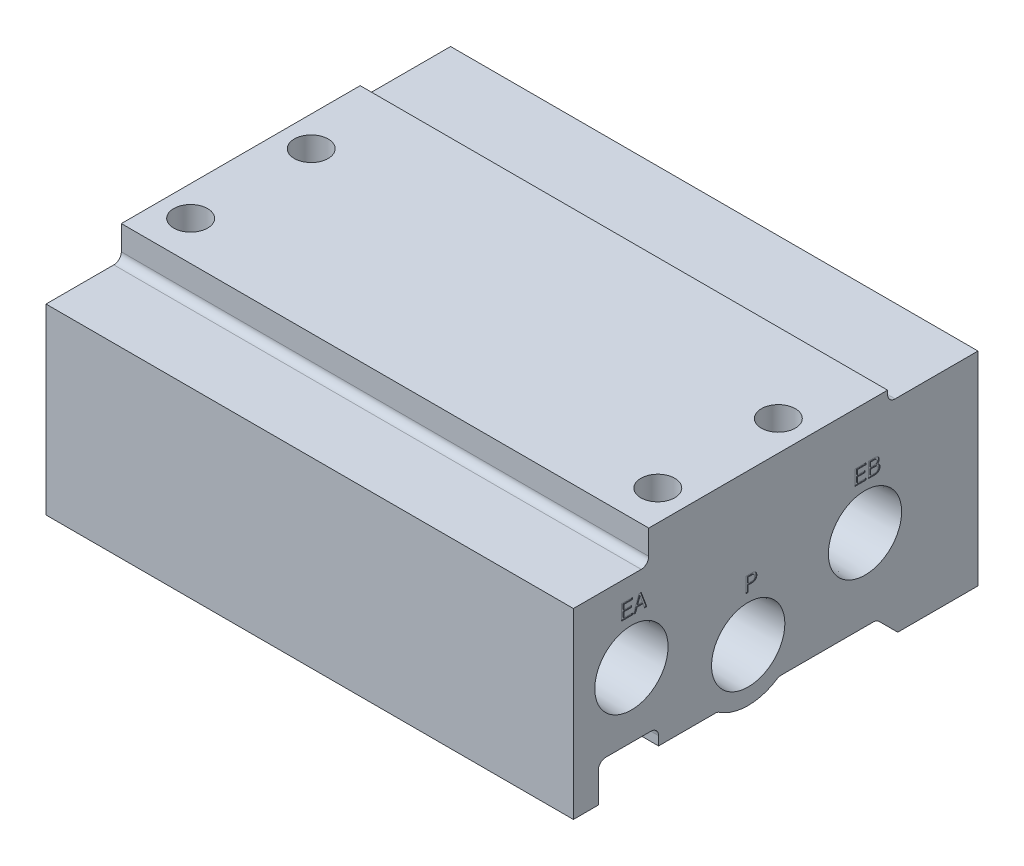
from build123d import *

# Parameters (mm, degrees)
ALUM_EXT_SKETCH_W          = 53.7
ALUM_EXT_SKETCH_H          = 28.5
ALUM_EXT_DEPTH             = 70
MGT_HOLES_SKETCH_R         = 2.25
MGT_HOLES_DEPTH            = 81.207060163
TOP_PROFILE_41_SKETCH_W    = 10
TOP_PROFILE_41_SKETCH_H    = 4.25
TOP_PROFILE_41_SKETCH_W_2  = 12
TOP_PROFILE_41_SKETCH_H_2  = 1.5
TOP_PROFILE_41_DEPTH       = 81.207060163
BOTTOM_PROFILE_41_DEPTH    = 81.207060163
ROUNDS_41_R                = 1
PORTS_AT_2_COUNT           = 2
PORTS_AT_2_PITCH           = 16.317475295
PORTS_AT_3_COUNT           = 2
PORTS_AT_3_PITCH           = 16.317475295
PORTS_MIRROR_AT_2_COUNT    = 2
PORTS_MIRROR_AT_2_PITCH    = 16.317475295
PORTS_MIRROR_AT_3_COUNT    = 2
PORTS_MIRROR_AT_3_PITCH    = 31
F_41_42_PORT_LABELS1_DEPTH = 0.1
F_41_42_PORT_LABELS2_DEPTH = 0.1
F_41_42_A_B_LABELS_DEPTH   = 0.1


with BuildPart() as part:
    # Alum Ext Sketch → Alum Ext (new body)
    with BuildSketch(Plane(origin=(0, 0, 0), x_dir=(0, 0, -1), z_dir=(1, 0, 0))):
        with Locations((0, -14.25)):
            Rectangle(ALUM_EXT_SKETCH_W, ALUM_EXT_SKETCH_H)
    extrude(amount=-ALUM_EXT_DEPTH)

    # MGT_Holes Sketch → MGT_Holes (cut, through all)
    with BuildSketch(Plane(origin=(0, 0, 0), x_dir=(1, 0, 0), z_dir=(0, 1, 0))):
        with Locations(Location((-66, 4.35, 0), (0, 0, 270))):
            Circle(MGT_HOLES_SKETCH_R)
        with Locations(Location((-66, -11.65, 0), (0, 0, 90))):
            Circle(MGT_HOLES_SKETCH_R)
        with Locations(Location((-4, 4.35, 0), (0, 0, 270))):
            Circle(MGT_HOLES_SKETCH_R)
        with Locations(Location((-4, -11.65, 0), (0, 0, 270))):
            Circle(MGT_HOLES_SKETCH_R)
    extrude(amount=-MGT_HOLES_DEPTH, mode=Mode.SUBTRACT)

    # Top_Profile_41 Sketch → Top_Profile_41 (cut, through all)
    with BuildSketch(Plane(origin=(0, 0, 0), x_dir=(0, 0, -1), z_dir=(1, 0, 0))):
        with Locations((-21.85, -2.125)):
            Rectangle(TOP_PROFILE_41_SKETCH_W, TOP_PROFILE_41_SKETCH_H)
        with Locations((20.85, -0.75)):
            Rectangle(TOP_PROFILE_41_SKETCH_W_2, TOP_PROFILE_41_SKETCH_H_2)
    extrude(amount=-TOP_PROFILE_41_DEPTH, mode=Mode.SUBTRACT)

    # Bottom_Profile_41 Sketch → Bottom_Profile_41 (cut, through all)
    with BuildSketch(Plane(origin=(0, 0, 0), x_dir=(0, 0, -1), z_dir=(1, 0, 0))):
        with BuildLine():
            Line((16.2, -28.5), (13.4, -25.7))
            Line((13.4, -25.7), (0.413249931, -25.7))
            ThreePointArc((0.413249931, -25.7), (-3.65, -27), (-7.713249931, -25.7))
            Line((-7.713249931, -25.7), (-15.55, -25.7))
            Line((-15.55, -25.7), (-15.55, -23.5))
            Line((-15.55, -23.5), (-23.55, -23.5))
            Line((-23.55, -23.5), (-23.55, -28.5))
            Line((-23.55, -28.5), (16.2, -28.5))
        make_face()
    extrude(amount=-BOTTOM_PROFILE_41_DEPTH, mode=Mode.SUBTRACT)

    # Rounds_41
    rounds_41_edges = [part.edges().sort_by_distance(p)[0] for p in [
        (-35, -4.25, 16.85),
        (-35, -1.5, -14.85),
        (-35, -25.7, -0.413249931),
        (-35, -23.5, 23.55),
        (-35, -23.5, 15.55),
        (-35, -25.7, 7.713249931),
        (-35, -25.7, -13.4),
    ]]
    fillet(rounds_41_edges, radius=ROUNDS_41_R)

    # Ports Profile Sketch → Ports (revolve, cut)
    with BuildSketch(Plane(origin=(0, -20, 3.65), x_dir=(0, 0, -1), z_dir=(0, 1, 0))):
        Polygon((0, 0), (0, 22.45), (3.95, 18.5), (3.95, 7.4), (4.632997004, 7.4), (4.864, 0), align=None)
    ports = revolve(axis=Axis((6.35, -20, 3.65), (-1, 0, 0)), mode=Mode.SUBTRACT)

    # Ports at 2: Ports ×2
    with Locations(*[Vector(0, 0.3125483512508122, -0.9499018518407042) * (i * PORTS_AT_2_PITCH) for i in range(1, PORTS_AT_2_COUNT)]):
        add(ports, mode=Mode.SUBTRACT)

    # Ports at 3: Ports ×2
    with Locations(*[Vector(0, 0.3125483512508122, 0.9499018518407041) * (i * PORTS_AT_3_PITCH) for i in range(1, PORTS_AT_3_COUNT)]):
        add(ports, mode=Mode.SUBTRACT)

    # Ports Mirror Profile Sketch → Ports Mirror (revolve, cut)
    with BuildSketch(Plane(origin=(-70, -14.9, -11.85), x_dir=(0, 0, 1), z_dir=(0, 1, 0))):
        Polygon((0, 0), (0, 15.885), (3.95, 11.935), (3.95, 7.4), (4.632997004, 7.4), (4.864, 0), align=None)
    ports_mirror = revolve(axis=Axis((-76.35, -14.9, -11.85), (1, 0, 0)), mode=Mode.SUBTRACT)

    # Ports Mirror at 2: Ports Mirror ×2
    with Locations(*[Vector(0, -0.3125483512508122, 0.9499018518407042) * (i * PORTS_MIRROR_AT_2_PITCH) for i in range(1, PORTS_MIRROR_AT_2_COUNT)]):
        add(ports_mirror, mode=Mode.SUBTRACT)

    # Ports Mirror at 3: Ports Mirror ×2
    with Locations(*[(0, 0, i * PORTS_MIRROR_AT_3_PITCH) for i in range(1, PORTS_MIRROR_AT_3_COUNT)]):
        add(ports_mirror, mode=Mode.SUBTRACT)

    # 41,42 Port Labels1 Sketch → 41,42 Port Labels1 (cut)
    # profile 1 of 5: a face of its own
    with BuildSketch(Plane.ZY.offset(70)):
        Polygon((-13.144871795, -8.9), (-13.144871795, -6.9), (-11.731410256, -6.9), (-11.731410256, -7.130769231), (-12.862820513, -7.130769231), (-12.862820513, -7.746153846), (-11.817948718, -7.746153846), (-11.817948718, -7.976923077), (-12.862820513, -7.976923077), (-12.862820513, -8.669230769), (-11.708974359, -8.669230769), (-11.708974359, -8.9), align=None)
    # profile 2 of 5: a face of its own
    with BuildSketch(Plane.ZY.offset(70)):
        with BuildLine():
            Line((-11.375641026, -8.9), (-11.375641026, -6.9))
            Line((-11.375641026, -6.9), (-10.582371795, -6.9))
            add(Edge.make_bspline(
                [(-10.582371795, -6.9), (-10.557520601, -6.900391088), (-10.509221677, -6.901151178), (-10.439257463, -6.906808568), (-10.373884128, -6.915794729), (-10.313491954, -6.928977632), (-10.25772712, -6.945607443), (-10.206981233, -6.966644139), (-10.160714162, -6.990826937), (-10.119486132, -7.019131964), (-10.082912178, -7.050918934), (-10.051607199, -7.087006382), (-10.024425363, -7.126312863), (-10.002795087, -7.169699096), (-9.985826511, -7.216613207), (-9.974014126, -7.267309873), (-9.966656438, -7.321659157), (-9.965816477, -7.359110147), (-9.965384615, -7.378365385)],
                knots=[0, 0, 0, 0, 1.338531614, 2.601470082, 3.778553788, 4.890456792, 5.928162005, 6.908738963, 7.84520586, 8.735147048, 9.596633689, 10.447968487, 11.301973765, 12.164180963, 13.051676454, 13.983434255, 14.963192844, 16, 16, 16, 16], degree=3))
            add(Edge.make_bspline(
                [(-9.965384615, -7.378365385), (-9.966331591, -7.402996395), (-9.968168925, -7.450785796), (-9.981718133, -7.519887959), (-10.005663085, -7.582918484), (-10.038410282, -7.640323126), (-10.080645807, -7.691469707), (-10.132507487, -7.735784439), (-10.193110711, -7.77443215), (-10.238424067, -7.793555438), (-10.261858974, -7.803445513)],
                knots=[0, 0, 0, 0, 1.064089938, 2.064560856, 3.027045975, 3.965441717, 4.908263127, 5.877849772, 6.902478258, 8, 8, 8, 8], degree=3))
            add(Edge.make_bspline(
                [(-10.261858974, -7.803445513), (-10.246569522, -7.806518626), (-10.216485798, -7.812565323), (-10.17316555, -7.826052918), (-10.132251748, -7.841956303), (-10.093880076, -7.860736947), (-10.058519403, -7.883036867), (-10.02554128, -7.907811801), (-9.995201163, -7.935720854), (-9.967752142, -7.966578157), (-9.94267115, -7.999705375), (-9.921668464, -8.035541546), (-9.903328698, -8.073092565), (-9.888526343, -8.112963113), (-9.876994446, -8.155075497), (-9.868507088, -8.199259529), (-9.863726514, -8.245513022), (-9.863126284, -8.276992465), (-9.862820513, -8.293028846)],
                knots=[0, 0, 0, 0, 1.079472139, 2.123983387, 3.137357801, 4.117691995, 5.07752268, 6.028353704, 6.970961659, 7.927265266, 8.885490285, 9.843581377, 10.799169054, 11.776706782, 12.784239396, 13.820032524, 14.889472473, 16, 16, 16, 16], degree=3))
            add(Edge.make_bspline(
                [(-9.862820513, -8.293028846), (-9.863272496, -8.315767522), (-9.864153514, -8.360090374), (-9.873541022, -8.424660596), (-9.887061044, -8.485768657), (-9.907353971, -8.543283868), (-9.933566292, -8.597000116), (-9.964872333, -8.647657469), (-10.002489133, -8.694254066), (-10.045355165, -8.737068494), (-10.093055612, -8.775646479), (-10.145401463, -8.808971319), (-10.201906819, -8.836986969), (-10.262136906, -8.860475813), (-10.326816833, -8.877901069), (-10.395416655, -8.890532564), (-10.468116052, -8.898929064), (-10.517977934, -8.899637332), (-10.543509615, -8.9)],
                knots=[0, 0, 0, 0, 1.058427598, 2.063116183, 3.033417234, 3.969927738, 4.896405358, 5.812972495, 6.737861532, 7.679194237, 8.630321786, 9.589794139, 10.563499171, 11.563941868, 12.596215416, 13.678433312, 14.811246201, 16, 16, 16, 16], degree=3))
            Line((-10.543509615, -8.9), (-11.375641026, -8.9))
        make_face()
        with BuildLine():
            Line((-11.093589744, -7.720512821), (-10.638060897, -7.720512821))
            add(Edge.make_bspline(
                [(-10.638060897, -7.720512821), (-10.62189856, -7.72024581), (-10.59060934, -7.719728896), (-10.545208349, -7.716795414), (-10.503095771, -7.710636868), (-10.464283505, -7.702711026), (-10.428663129, -7.693061693), (-10.39684222, -7.679824467), (-10.367793522, -7.665385266), (-10.342235553, -7.64779035), (-10.319629027, -7.628173795), (-10.300015633, -7.605914124), (-10.284162537, -7.580643527), (-10.270210543, -7.55333256), (-10.259923231, -7.523089629), (-10.252860224, -7.490409561), (-10.248348588, -7.45527911), (-10.247747178, -7.430997327), (-10.247435897, -7.418429487)],
                knots=[0, 0, 0, 0, 1.368886017, 2.65007316, 3.849640785, 4.969751217, 6.004381673, 6.968357812, 7.883879336, 8.746530739, 9.588092002, 10.41369514, 11.248159001, 12.107988605, 13.005734059, 13.944160956, 14.935932503, 16, 16, 16, 16], degree=3))
            add(Edge.make_bspline(
                [(-10.247435897, -7.418429487), (-10.24779526, -7.406534873), (-10.248487838, -7.383611119), (-10.252344592, -7.350275069), (-10.259615487, -7.319417291), (-10.2694704, -7.29082689), (-10.28256798, -7.264808482), (-10.298163447, -7.241021057), (-10.316774453, -7.219617856), (-10.338193209, -7.200634591), (-10.362634513, -7.184106045), (-10.389977449, -7.169577213), (-10.420615726, -7.157824898), (-10.454032304, -7.147613488), (-10.490564803, -7.140314754), (-10.529999659, -7.134572338), (-10.572575304, -7.131523238), (-10.60199904, -7.131026383), (-10.617227564, -7.130769231)],
                knots=[0, 0, 0, 0, 1.064043854, 2.05066597, 2.995108535, 3.894129092, 4.74873584, 5.593437176, 6.431611697, 7.277662936, 8.145602371, 9.064553025, 10.040417484, 11.075719197, 12.186014413, 13.368359838, 14.637970495, 16, 16, 16, 16], degree=3))
            Line((-10.617227564, -7.130769231), (-11.093589744, -7.130769231))
            Line((-11.093589744, -7.130769231), (-11.093589744, -7.720512821))
        make_face(mode=Mode.SUBTRACT)
        with BuildLine():
            Line((-11.093589744, -8.669230769), (-10.566746795, -8.669230769))
            add(Edge.make_bspline(
                [(-10.566746795, -8.669230769), (-10.549908372, -8.668922161), (-10.517373227, -8.668325869), (-10.470137599, -8.663774034), (-10.425994956, -8.656854934), (-10.385013028, -8.64634983), (-10.346971081, -8.633180858), (-10.312127837, -8.616877954), (-10.280547117, -8.597345386), (-10.251784041, -8.575352814), (-10.226609275, -8.550046268), (-10.204679995, -8.522071895), (-10.186188284, -8.49137213), (-10.170917321, -8.458069746), (-10.159316799, -8.421991925), (-10.151012013, -8.383343954), (-10.145625468, -8.342058175), (-10.145127121, -8.313612472), (-10.144871795, -8.299038462)],
                knots=[0, 0, 0, 0, 1.261340787, 2.437158505, 3.552412744, 4.605618057, 5.602418951, 6.564726798, 7.481099983, 8.379712099, 9.271165627, 10.147841252, 11.036708081, 11.950072001, 12.886651798, 13.869902527, 14.90865543, 16, 16, 16, 16], degree=3))
            add(Edge.make_bspline(
                [(-10.144871795, -8.299038462), (-10.145117446, -8.284595974), (-10.145594563, -8.256544995), (-10.151054338, -8.215943132), (-10.159140342, -8.17810658), (-10.171288059, -8.143473319), (-10.18652651, -8.111724261), (-10.205588286, -8.083183638), (-10.227647172, -8.057184402), (-10.253710324, -8.034583368), (-10.28331899, -8.01494812), (-10.31638283, -7.997503895), (-10.353598, -7.98333953), (-10.394496601, -7.971081379), (-10.439692519, -7.962804431), (-10.488439021, -7.955798704), (-10.541174333, -7.951838231), (-10.577557944, -7.951471772), (-10.596394231, -7.951282051)],
                knots=[0, 0, 0, 0, 1.058252033, 2.055394168, 2.998523969, 3.890395008, 4.739981298, 5.573732922, 6.40003374, 7.23274972, 8.093659094, 9.000297479, 9.967667442, 11.00874663, 12.12639854, 13.332554366, 14.619027337, 16, 16, 16, 16], degree=3))
            Line((-10.596394231, -7.951282051), (-11.093589744, -7.951282051))
            Line((-11.093589744, -7.951282051), (-11.093589744, -8.669230769))
        make_face(mode=Mode.SUBTRACT)
    # profile 3 of 5: a face of its own
    with BuildSketch(Plane.ZY.offset(70)):
        with BuildLine():
            Line((3.355128205, -14), (3.355128205, -12))
            Line((3.355128205, -12), (4.095913462, -12))
            add(Edge.make_bspline(
                [(4.095913462, -12), (4.12409362, -12.000249378), (4.177002091, -12.000717587), (4.250934098, -12.003608091), (4.314154858, -12.009200397), (4.368073681, -12.016451865), (4.415166702, -12.02754219), (4.458606554, -12.040013914), (4.499344903, -12.056098279), (4.524832794, -12.069234093), (4.537419872, -12.075721154)],
                knots=[0, 0, 0, 0, 1.493455121, 2.803973871, 3.919514338, 4.856337602, 5.683863995, 6.481055044, 7.249876038, 8, 8, 8, 8], degree=3))
            add(Edge.make_bspline(
                [(4.537419872, -12.075721154), (4.557109161, -12.087505308), (4.596238242, -12.110924292), (4.646867088, -12.157428597), (4.691435381, -12.210646113), (4.726929673, -12.2725773), (4.756116688, -12.340350372), (4.776198097, -12.414407034), (4.789029685, -12.493809121), (4.790347685, -12.548692188), (4.791025641, -12.576923077)],
                knots=[0, 0, 0, 0, 0.930560885, 1.849329941, 2.778623248, 3.742228717, 4.739438803, 5.770715934, 6.853295292, 8, 8, 8, 8], degree=3))
            add(Edge.make_bspline(
                [(4.791025641, -12.576923077), (4.790347059, -12.603953612), (4.78902587, -12.65658169), (4.776100386, -12.733053307), (4.755916476, -12.804708226), (4.727367087, -12.871331941), (4.690898401, -12.932063622), (4.64652939, -12.986531524), (4.594678687, -13.034755885), (4.555051994, -13.060899771), (4.535016026, -13.07411859)],
                knots=[0, 0, 0, 0, 1.106237948, 2.15382993, 3.166616047, 4.14912887, 5.113446575, 6.058253874, 7.018218259, 8, 8, 8, 8], degree=3))
            add(Edge.make_bspline(
                [(4.535016026, -13.07411859), (4.522597077, -13.081071894), (4.497311506, -13.095229151), (4.456117103, -13.111618603), (4.412179284, -13.125952788), (4.372704814, -13.134789239), (4.337996409, -13.140616309), (4.307779075, -13.144194947), (4.273668896, -13.146691653), (4.235640761, -13.149761537), (4.193551564, -13.151643471), (4.147467197, -13.152726574), (4.097518693, -13.153554018), (4.06292769, -13.153746548), (4.045032051, -13.153846154)],
                knots=[0, 0, 0, 0, 1.018466528, 2.073646265, 3.168741587, 4.32666575, 4.966710573, 5.68928523, 6.505122404, 7.416327688, 8.421864515, 9.522294478, 10.718160255, 12, 12, 12, 12], degree=3))
            Line((4.045032051, -13.153846154), (3.637179487, -13.153846154))
            Line((3.637179487, -13.153846154), (3.637179487, -14))
            Line((3.637179487, -14), (3.355128205, -14))
        make_face()
        with BuildLine():
            Line((3.637179487, -12.923076923), (4.087900641, -12.923076923))
            add(Edge.make_bspline(
                [(4.087900641, -12.923076923), (4.106734424, -12.922848085), (4.142970313, -12.922407806), (4.195182234, -12.919020543), (4.2428652, -12.912380011), (4.286306282, -12.90452837), (4.324991337, -12.892914993), (4.359724875, -12.880257808), (4.389709515, -12.863882812), (4.415997913, -12.84536947), (4.43829063, -12.823331396), (4.457379289, -12.798065143), (4.473409826, -12.769311124), (4.486624477, -12.737183964), (4.496532941, -12.70151272), (4.503634352, -12.662491291), (4.508057153, -12.619891899), (4.508660905, -12.590288992), (4.508974359, -12.574919872)],
                knots=[0, 0, 0, 0, 1.418142734, 2.728483292, 3.935852239, 5.042182902, 6.047730313, 6.973980857, 7.819836916, 8.612371598, 9.387426252, 10.169752478, 10.989196503, 11.859387264, 12.779284547, 13.771317079, 14.842921177, 16, 16, 16, 16], degree=3))
            add(Edge.make_bspline(
                [(4.508974359, -12.574919872), (4.508621001, -12.560087188), (4.507941592, -12.531568007), (4.504041052, -12.490281163), (4.497103925, -12.452223938), (4.486320171, -12.417522781), (4.473955018, -12.385611284), (4.457636989, -12.357322195), (4.43872536, -12.332221086), (4.416721841, -12.31008833), (4.391039013, -12.291246478), (4.361972539, -12.274585285), (4.328843401, -12.261233914), (4.292121529, -12.249962633), (4.251491521, -12.241304691), (4.207065619, -12.234912843), (4.15873708, -12.23141909), (4.125299202, -12.230991373), (4.107932692, -12.230769231)],
                knots=[0, 0, 0, 0, 1.160442503, 2.231212519, 3.241398704, 4.180061104, 5.070566702, 5.91288362, 6.725721963, 7.523583634, 8.344772017, 9.210415603, 10.137847341, 11.13257169, 12.212527806, 13.384203378, 14.64144318, 16, 16, 16, 16], degree=3))
            Line((4.107932692, -12.230769231), (3.637179487, -12.230769231))
            Line((3.637179487, -12.230769231), (3.637179487, -12.923076923))
        make_face(mode=Mode.SUBTRACT)
    # profile 4 of 5: a face of its own
    with BuildSketch(Plane.ZY.offset(70)):
        Polygon((17.855128205, -8.9), (17.855128205, -6.9), (19.268589744, -6.9), (19.268589744, -7.130769231), (18.137179487, -7.130769231), (18.137179487, -7.746153846), (19.182051282, -7.746153846), (19.182051282, -7.976923077), (18.137179487, -7.976923077), (18.137179487, -8.669230769), (19.291025641, -8.669230769), (19.291025641, -8.9), align=None)
    # profile 5 of 5: a face of its own
    with BuildSketch(Plane.ZY.offset(70)):
        Polygon((19.419230769, -8.9), (20.149198718, -6.9), (20.447676282, -6.9), (21.188461538, -8.9), (20.895592949, -8.9), (20.68525641, -8.31025641), (19.902403846, -8.31025641), (19.690464744, -8.9), align=None)
        Polygon((19.986137821, -8.079487179), (20.605528846, -8.079487179), (20.297836538, -7.188862179), align=None, mode=Mode.SUBTRACT)
    extrude(amount=-F_41_42_PORT_LABELS1_DEPTH, mode=Mode.SUBTRACT)

    # 41,42 Port Labels2 Sketch → 41,42 Port Labels2 (cut)
    # profile 1 of 5: a face of its own
    with BuildSketch(Plane(origin=(0, 0, 0), x_dir=(0, 0, -1), z_dir=(1, 0, 0))):
        Polygon((-20.444871795, -8.9), (-20.444871795, -6.9), (-19.031410256, -6.9), (-19.031410256, -7.130769231), (-20.162820513, -7.130769231), (-20.162820513, -7.746153846), (-19.117948718, -7.746153846), (-19.117948718, -7.976923077), (-20.162820513, -7.976923077), (-20.162820513, -8.669230769), (-19.008974359, -8.669230769), (-19.008974359, -8.9), align=None)
    # profile 2 of 5: a face of its own
    with BuildSketch(Plane(origin=(0, 0, 0), x_dir=(0, 0, -1), z_dir=(1, 0, 0))):
        Polygon((-18.880769231, -8.9), (-18.150801282, -6.9), (-17.852323718, -6.9), (-17.111538462, -8.9), (-17.404407051, -8.9), (-17.61474359, -8.31025641), (-18.397596154, -8.31025641), (-18.609535256, -8.9), align=None)
        Polygon((-18.313862179, -8.079487179), (-17.694471154, -8.079487179), (-18.002163462, -7.188862179), align=None, mode=Mode.SUBTRACT)
    # profile 3 of 5: a face of its own
    with BuildSketch(Plane(origin=(0, 0, 0), x_dir=(0, 0, -1), z_dir=(1, 0, 0))):
        with BuildLine():
            Line((-3.944871795, -14), (-3.944871795, -12))
            Line((-3.944871795, -12), (-3.204086538, -12))
            add(Edge.make_bspline(
                [(-3.204086538, -12), (-3.17590638, -12.000249378), (-3.122997909, -12.000717587), (-3.049065902, -12.003608091), (-2.985845142, -12.009200397), (-2.931926319, -12.016451865), (-2.884833298, -12.02754219), (-2.841393446, -12.040013914), (-2.800655097, -12.056098279), (-2.775167206, -12.069234093), (-2.762580128, -12.075721154)],
                knots=[0, 0, 0, 0, 1.493455121, 2.803973871, 3.919514338, 4.856337602, 5.683863995, 6.481055044, 7.249876038, 8, 8, 8, 8], degree=3))
            add(Edge.make_bspline(
                [(-2.762580128, -12.075721154), (-2.742890839, -12.087505308), (-2.703761758, -12.110924292), (-2.653132912, -12.157428597), (-2.608564619, -12.210646113), (-2.573070327, -12.2725773), (-2.543883312, -12.340350372), (-2.523801903, -12.414407034), (-2.510970315, -12.493809121), (-2.509652315, -12.548692188), (-2.508974359, -12.576923077)],
                knots=[0, 0, 0, 0, 0.930560885, 1.849329941, 2.778623248, 3.742228717, 4.739438803, 5.770715934, 6.853295292, 8, 8, 8, 8], degree=3))
            add(Edge.make_bspline(
                [(-2.508974359, -12.576923077), (-2.509652941, -12.603953612), (-2.51097413, -12.65658169), (-2.523899614, -12.733053307), (-2.544083524, -12.804708226), (-2.572632913, -12.871331941), (-2.609101599, -12.932063622), (-2.65347061, -12.986531524), (-2.705321313, -13.034755885), (-2.744948006, -13.060899771), (-2.764983974, -13.07411859)],
                knots=[0, 0, 0, 0, 1.106237948, 2.15382993, 3.166616047, 4.14912887, 5.113446575, 6.058253874, 7.018218259, 8, 8, 8, 8], degree=3))
            add(Edge.make_bspline(
                [(-2.764983974, -13.07411859), (-2.777402923, -13.081071894), (-2.802688494, -13.095229151), (-2.843882897, -13.111618603), (-2.887820716, -13.125952788), (-2.927295186, -13.134789239), (-2.962003591, -13.140616309), (-2.992220925, -13.144194947), (-3.026331104, -13.146691653), (-3.064359239, -13.149761537), (-3.106448436, -13.151643471), (-3.152532803, -13.152726574), (-3.202481307, -13.153554018), (-3.23707231, -13.153746548), (-3.254967949, -13.153846154)],
                knots=[0, 0, 0, 0, 1.018466528, 2.073646265, 3.168741587, 4.32666575, 4.966710573, 5.68928523, 6.505122404, 7.416327688, 8.421864515, 9.522294478, 10.718160255, 12, 12, 12, 12], degree=3))
            Line((-3.254967949, -13.153846154), (-3.662820513, -13.153846154))
            Line((-3.662820513, -13.153846154), (-3.662820513, -14))
            Line((-3.662820513, -14), (-3.944871795, -14))
        make_face()
        with BuildLine():
            Line((-3.662820513, -12.923076923), (-3.212099359, -12.923076923))
            add(Edge.make_bspline(
                [(-3.212099359, -12.923076923), (-3.193265576, -12.922848085), (-3.157029687, -12.922407806), (-3.104817766, -12.919020543), (-3.0571348, -12.912380011), (-3.013693718, -12.90452837), (-2.975008663, -12.892914993), (-2.940275125, -12.880257808), (-2.910290485, -12.863882812), (-2.884002087, -12.84536947), (-2.86170937, -12.823331396), (-2.842620711, -12.798065143), (-2.826590174, -12.769311124), (-2.813375523, -12.737183964), (-2.803467059, -12.70151272), (-2.796365648, -12.662491291), (-2.791942847, -12.619891899), (-2.791339095, -12.590288992), (-2.791025641, -12.574919872)],
                knots=[0, 0, 0, 0, 1.418142734, 2.728483292, 3.935852239, 5.042182902, 6.047730313, 6.973980857, 7.819836916, 8.612371598, 9.387426252, 10.169752478, 10.989196503, 11.859387264, 12.779284547, 13.771317079, 14.842921177, 16, 16, 16, 16], degree=3))
            add(Edge.make_bspline(
                [(-2.791025641, -12.574919872), (-2.791378999, -12.560087188), (-2.792058408, -12.531568007), (-2.795958948, -12.490281163), (-2.802896075, -12.452223938), (-2.813679829, -12.417522781), (-2.826044982, -12.385611284), (-2.842363011, -12.357322195), (-2.86127464, -12.332221086), (-2.883278159, -12.31008833), (-2.908960987, -12.291246478), (-2.938027461, -12.274585285), (-2.971156599, -12.261233914), (-3.007878471, -12.249962633), (-3.048508479, -12.241304691), (-3.092934381, -12.234912843), (-3.14126292, -12.23141909), (-3.174700798, -12.230991373), (-3.192067308, -12.230769231)],
                knots=[0, 0, 0, 0, 1.160442503, 2.231212519, 3.241398704, 4.180061104, 5.070566702, 5.91288362, 6.725721963, 7.523583634, 8.344772017, 9.210415603, 10.137847341, 11.13257169, 12.212527806, 13.384203378, 14.64144318, 16, 16, 16, 16], degree=3))
            Line((-3.192067308, -12.230769231), (-3.662820513, -12.230769231))
            Line((-3.662820513, -12.230769231), (-3.662820513, -12.923076923))
        make_face(mode=Mode.SUBTRACT)
    # profile 4 of 5: a face of its own
    with BuildSketch(Plane(origin=(0, 0, 0), x_dir=(0, 0, -1), z_dir=(1, 0, 0))):
        Polygon((10.555128205, -8.9), (10.555128205, -6.9), (11.968589744, -6.9), (11.968589744, -7.130769231), (10.837179487, -7.130769231), (10.837179487, -7.746153846), (11.882051282, -7.746153846), (11.882051282, -7.976923077), (10.837179487, -7.976923077), (10.837179487, -8.669230769), (11.991025641, -8.669230769), (11.991025641, -8.9), align=None)
    # profile 5 of 5: a face of its own
    with BuildSketch(Plane(origin=(0, 0, 0), x_dir=(0, 0, -1), z_dir=(1, 0, 0))):
        with BuildLine():
            Line((12.324358974, -8.9), (12.324358974, -6.9))
            Line((12.324358974, -6.9), (13.117628205, -6.9))
            add(Edge.make_bspline(
                [(13.117628205, -6.9), (13.142479399, -6.900391088), (13.190778323, -6.901151178), (13.260742537, -6.906808568), (13.326115872, -6.915794729), (13.386508046, -6.928977632), (13.44227288, -6.945607443), (13.493018767, -6.966644139), (13.539285838, -6.990826937), (13.580513868, -7.019131964), (13.617087822, -7.050918934), (13.648392801, -7.087006382), (13.675574637, -7.126312863), (13.697204913, -7.169699096), (13.714173489, -7.216613207), (13.725985874, -7.267309873), (13.733343562, -7.321659157), (13.734183523, -7.359110147), (13.734615385, -7.378365385)],
                knots=[0, 0, 0, 0, 1.338531614, 2.601470082, 3.778553788, 4.890456792, 5.928162005, 6.908738963, 7.84520586, 8.735147048, 9.596633689, 10.447968487, 11.301973765, 12.164180963, 13.051676454, 13.983434255, 14.963192844, 16, 16, 16, 16], degree=3))
            add(Edge.make_bspline(
                [(13.734615385, -7.378365385), (13.733668409, -7.402996395), (13.731831075, -7.450785796), (13.718281867, -7.519887959), (13.694336915, -7.582918484), (13.661589718, -7.640323126), (13.619354193, -7.691469707), (13.567492513, -7.735784439), (13.506889289, -7.77443215), (13.461575933, -7.793555438), (13.438141026, -7.803445513)],
                knots=[0, 0, 0, 0, 1.064089938, 2.064560856, 3.027045975, 3.965441717, 4.908263127, 5.877849772, 6.902478258, 8, 8, 8, 8], degree=3))
            add(Edge.make_bspline(
                [(13.438141026, -7.803445513), (13.453430478, -7.806518626), (13.483514202, -7.812565323), (13.52683445, -7.826052918), (13.567748252, -7.841956303), (13.606119924, -7.860736947), (13.641480597, -7.883036867), (13.67445872, -7.907811801), (13.704798837, -7.935720854), (13.732247858, -7.966578157), (13.75732885, -7.999705375), (13.778331536, -8.035541546), (13.796671302, -8.073092565), (13.811473657, -8.112963113), (13.823005554, -8.155075497), (13.831492912, -8.199259529), (13.836273486, -8.245513022), (13.836873716, -8.276992465), (13.837179487, -8.293028846)],
                knots=[0, 0, 0, 0, 1.079472139, 2.123983387, 3.137357801, 4.117691995, 5.07752268, 6.028353704, 6.970961659, 7.927265266, 8.885490285, 9.843581377, 10.799169054, 11.776706782, 12.784239396, 13.820032524, 14.889472473, 16, 16, 16, 16], degree=3))
            add(Edge.make_bspline(
                [(13.837179487, -8.293028846), (13.836727504, -8.315767522), (13.835846486, -8.360090374), (13.826458978, -8.424660596), (13.812938956, -8.485768657), (13.792646029, -8.543283868), (13.766433708, -8.597000116), (13.735127667, -8.647657469), (13.697510867, -8.694254066), (13.654644835, -8.737068494), (13.606944388, -8.775646479), (13.554598537, -8.808971319), (13.498093181, -8.836986969), (13.437863094, -8.860475813), (13.373183167, -8.877901069), (13.304583345, -8.890532564), (13.231883948, -8.898929064), (13.182022066, -8.899637332), (13.156490385, -8.9)],
                knots=[0, 0, 0, 0, 1.058427598, 2.063116183, 3.033417234, 3.969927738, 4.896405358, 5.812972495, 6.737861532, 7.679194237, 8.630321786, 9.589794139, 10.563499171, 11.563941868, 12.596215416, 13.678433312, 14.811246201, 16, 16, 16, 16], degree=3))
            Line((13.156490385, -8.9), (12.324358974, -8.9))
        make_face()
        with BuildLine():
            Line((12.606410256, -7.720512821), (13.061939103, -7.720512821))
            add(Edge.make_bspline(
                [(13.061939103, -7.720512821), (13.07810144, -7.72024581), (13.10939066, -7.719728896), (13.154791651, -7.716795414), (13.196904229, -7.710636868), (13.235716495, -7.702711026), (13.271336871, -7.693061693), (13.30315778, -7.679824467), (13.332206478, -7.665385266), (13.357764447, -7.64779035), (13.380370973, -7.628173795), (13.399984367, -7.605914124), (13.415837463, -7.580643527), (13.429789457, -7.55333256), (13.440076769, -7.523089629), (13.447139776, -7.490409561), (13.451651412, -7.45527911), (13.452252822, -7.430997327), (13.452564103, -7.418429487)],
                knots=[0, 0, 0, 0, 1.368886017, 2.65007316, 3.849640785, 4.969751217, 6.004381673, 6.968357812, 7.883879336, 8.746530739, 9.588092002, 10.41369514, 11.248159001, 12.107988605, 13.005734059, 13.944160956, 14.935932503, 16, 16, 16, 16], degree=3))
            add(Edge.make_bspline(
                [(13.452564103, -7.418429487), (13.45220474, -7.406534873), (13.451512162, -7.383611119), (13.447655408, -7.350275069), (13.440384513, -7.319417291), (13.4305296, -7.29082689), (13.41743202, -7.264808482), (13.401836553, -7.241021057), (13.383225547, -7.219617856), (13.361806791, -7.200634591), (13.337365487, -7.184106045), (13.310022551, -7.169577213), (13.279384274, -7.157824898), (13.245967696, -7.147613488), (13.209435197, -7.140314754), (13.170000341, -7.134572338), (13.127424696, -7.131523238), (13.09800096, -7.131026383), (13.082772436, -7.130769231)],
                knots=[0, 0, 0, 0, 1.064043854, 2.05066597, 2.995108535, 3.894129092, 4.74873584, 5.593437176, 6.431611697, 7.277662936, 8.145602371, 9.064553025, 10.040417484, 11.075719197, 12.186014413, 13.368359838, 14.637970495, 16, 16, 16, 16], degree=3))
            Line((13.082772436, -7.130769231), (12.606410256, -7.130769231))
            Line((12.606410256, -7.130769231), (12.606410256, -7.720512821))
        make_face(mode=Mode.SUBTRACT)
        with BuildLine():
            Line((12.606410256, -8.669230769), (13.133253205, -8.669230769))
            add(Edge.make_bspline(
                [(13.133253205, -8.669230769), (13.150091628, -8.668922161), (13.182626773, -8.668325869), (13.229862401, -8.663774034), (13.274005044, -8.656854934), (13.314986972, -8.64634983), (13.353028919, -8.633180858), (13.387872163, -8.616877954), (13.419452883, -8.597345386), (13.448215959, -8.575352814), (13.473390725, -8.550046268), (13.495320005, -8.522071895), (13.513811716, -8.49137213), (13.529082679, -8.458069746), (13.540683201, -8.421991925), (13.548987987, -8.383343954), (13.554374532, -8.342058175), (13.554872879, -8.313612472), (13.555128205, -8.299038462)],
                knots=[0, 0, 0, 0, 1.261340787, 2.437158505, 3.552412744, 4.605618057, 5.602418951, 6.564726798, 7.481099983, 8.379712099, 9.271165627, 10.147841252, 11.036708081, 11.950072001, 12.886651798, 13.869902527, 14.90865543, 16, 16, 16, 16], degree=3))
            add(Edge.make_bspline(
                [(13.555128205, -8.299038462), (13.554882554, -8.284595974), (13.554405437, -8.256544995), (13.548945662, -8.215943132), (13.540859658, -8.17810658), (13.528711941, -8.143473319), (13.51347349, -8.111724261), (13.494411714, -8.083183638), (13.472352828, -8.057184402), (13.446289676, -8.034583368), (13.41668101, -8.01494812), (13.38361717, -7.997503895), (13.346402, -7.98333953), (13.305503399, -7.971081379), (13.260307481, -7.962804431), (13.211560979, -7.955798704), (13.158825667, -7.951838231), (13.122442056, -7.951471772), (13.103605769, -7.951282051)],
                knots=[0, 0, 0, 0, 1.058252033, 2.055394168, 2.998523969, 3.890395008, 4.739981298, 5.573732922, 6.40003374, 7.23274972, 8.093659094, 9.000297479, 9.967667442, 11.00874663, 12.12639854, 13.332554366, 14.619027337, 16, 16, 16, 16], degree=3))
            Line((13.103605769, -7.951282051), (12.606410256, -7.951282051))
            Line((12.606410256, -7.951282051), (12.606410256, -8.669230769))
        make_face(mode=Mode.SUBTRACT)
    extrude(amount=-F_41_42_PORT_LABELS2_DEPTH, mode=Mode.SUBTRACT)

    # 41,42 A,B Labels Sketch → 41,42 A,B Labels (cut)
    # profile 1 of 4: a face of its own
    with BuildSketch(Plane.XY.offset(-26.85)):
        Polygon((-65.5, -10), (-66.77744391, -6.5), (-67.299779647, -6.5), (-68.596153846, -10), (-68.083633814, -10), (-67.715544872, -8.967948718), (-66.345552885, -8.967948718), (-65.974659455, -10), align=None)
        Polygon((-66.49208734, -8.564102564), (-67.576021635, -8.564102564), (-67.037560096, -7.005508814), align=None, mode=Mode.SUBTRACT)
    # profile 2 of 4: a face of its own
    with BuildSketch(Plane.XY.offset(-26.85)):
        with BuildLine():
            Line((-59.358974359, -23.5), (-59.358974359, -20))
            Line((-59.358974359, -20), (-60.747195513, -20))
            add(Edge.make_bspline(
                [(-60.747195513, -20), (-60.790685102, -20.000684404), (-60.875208219, -20.002014561), (-60.997645593, -20.011914994), (-61.11204893, -20.027640776), (-61.217735234, -20.050710856), (-61.315323694, -20.079813026), (-61.404128997, -20.116627242), (-61.485096371, -20.158947141), (-61.557245422, -20.208480936), (-61.621249843, -20.264108134), (-61.676033556, -20.327261168), (-61.723601769, -20.396047509), (-61.761454752, -20.471973419), (-61.79114976, -20.554073113), (-61.811821433, -20.642792277), (-61.824697388, -20.737903525), (-61.826167319, -20.803442756), (-61.826923077, -20.837139423)],
                knots=[0, 0, 0, 0, 1.338531614, 2.601470082, 3.778553788, 4.890456792, 5.928162005, 6.908738963, 7.84520586, 8.735147048, 9.596633689, 10.447968487, 11.301973765, 12.164180963, 13.051676454, 13.983434255, 14.963192844, 16, 16, 16, 16], degree=3))
            add(Edge.make_bspline(
                [(-61.826923077, -20.837139423), (-61.82526587, -20.880243692), (-61.822050535, -20.963875144), (-61.79833942, -21.084803928), (-61.756435755, -21.195107347), (-61.699128161, -21.295565471), (-61.625215992, -21.385071987), (-61.534458052, -21.462622768), (-61.428402409, -21.530256263), (-61.349104036, -21.563722017), (-61.308092949, -21.581029647)],
                knots=[0, 0, 0, 0, 1.064089938, 2.064560856, 3.027045975, 3.965441717, 4.908263127, 5.877849772, 6.902478258, 8, 8, 8, 8], degree=3))
            add(Edge.make_bspline(
                [(-61.308092949, -21.581029647), (-61.33484949, -21.586407596), (-61.387496008, -21.596989316), (-61.463306442, -21.620592607), (-61.534905595, -21.648423531), (-61.602056021, -21.681289657), (-61.663937199, -21.720314518), (-61.721648914, -21.763670652), (-61.774744119, -21.812511494), (-61.822779905, -21.866511775), (-61.866671641, -21.924484406), (-61.903426342, -21.987197706), (-61.935520932, -22.052911989), (-61.961425053, -22.122685447), (-61.981605873, -22.196382119), (-61.99645875, -22.273704176), (-62.004824755, -22.354647789), (-62.005875157, -22.409736815), (-62.006410256, -22.437800481)],
                knots=[0, 0, 0, 0, 1.079472139, 2.123983387, 3.137357801, 4.117691995, 5.07752268, 6.028353704, 6.970961659, 7.927265266, 8.885490285, 9.843581377, 10.799169054, 11.776706782, 12.784239396, 13.820032524, 14.889472473, 16, 16, 16, 16], degree=3))
            add(Edge.make_bspline(
                [(-62.006410256, -22.437800481), (-62.005619286, -22.477593164), (-62.004077505, -22.555158155), (-61.987649365, -22.668156042), (-61.963989327, -22.77509515), (-61.928476704, -22.875746769), (-61.882605143, -22.969750203), (-61.827819571, -23.058400571), (-61.761990171, -23.139944616), (-61.686974614, -23.214869865), (-61.603498834, -23.282381338), (-61.511893594, -23.340699808), (-61.41300922, -23.389727196), (-61.307606568, -23.430832673), (-61.194416695, -23.461326871), (-61.074367008, -23.483431987), (-60.947143063, -23.498125862), (-60.85988477, -23.499365332), (-60.815204327, -23.5)],
                knots=[0, 0, 0, 0, 1.058427598, 2.063116183, 3.033417234, 3.969927738, 4.896405358, 5.812972495, 6.737861532, 7.679194237, 8.630321786, 9.589794139, 10.563499171, 11.563941868, 12.596215416, 13.678433312, 14.811246201, 16, 16, 16, 16], degree=3))
            Line((-60.815204327, -23.5), (-59.358974359, -23.5))
        make_face()
        with BuildLine():
            Line((-59.852564103, -21.435897436), (-60.649739583, -21.435897436))
            add(Edge.make_bspline(
                [(-60.649739583, -21.435897436), (-60.678023674, -21.435430168), (-60.73277981, -21.434525568), (-60.812231542, -21.429391974), (-60.885928555, -21.418614519), (-60.953850021, -21.404744295), (-61.016185678, -21.387857963), (-61.071872268, -21.364692817), (-61.12270749, -21.339424215), (-61.167433937, -21.308633112), (-61.206995357, -21.274304141), (-61.241318795, -21.235349716), (-61.269061713, -21.191126172), (-61.293477703, -21.143331981), (-61.3114805, -21.09040685), (-61.323840762, -21.033216732), (-61.331736124, -20.971738443), (-61.332788593, -20.929245323), (-61.333333333, -20.907251603)],
                knots=[0, 0, 0, 0, 1.368886017, 2.65007316, 3.849640785, 4.969751217, 6.004381673, 6.968357812, 7.883879336, 8.746530739, 9.588092002, 10.41369514, 11.248159001, 12.107988605, 13.005734059, 13.944160956, 14.935932503, 16, 16, 16, 16], degree=3))
            add(Edge.make_bspline(
                [(-61.333333333, -20.907251603), (-61.332704448, -20.886436029), (-61.331492437, -20.846319459), (-61.324743118, -20.78798137), (-61.312019051, -20.733980259), (-61.294772954, -20.683947058), (-61.271852189, -20.638414843), (-61.244560122, -20.59678685), (-61.211990861, -20.559331249), (-61.174508037, -20.526110534), (-61.131735756, -20.497185578), (-61.083885618, -20.471760122), (-61.030268633, -20.451193571), (-60.971789621, -20.433323604), (-60.907857749, -20.42055082), (-60.83884675, -20.410501592), (-60.764339373, -20.405165666), (-60.712847835, -20.40429617), (-60.686197917, -20.403846154)],
                knots=[0, 0, 0, 0, 1.064043854, 2.05066597, 2.995108535, 3.894129092, 4.74873584, 5.593437176, 6.431611697, 7.277662936, 8.145602371, 9.064553025, 10.040417484, 11.075719197, 12.186014413, 13.368359838, 14.637970495, 16, 16, 16, 16], degree=3))
            Line((-60.686197917, -20.403846154), (-59.852564103, -20.403846154))
            Line((-59.852564103, -20.403846154), (-59.852564103, -21.435897436))
        make_face(mode=Mode.SUBTRACT)
        with BuildLine():
            Line((-59.852564103, -23.096153846), (-60.774539263, -23.096153846))
            add(Edge.make_bspline(
                [(-60.774539263, -23.096153846), (-60.804006503, -23.095613782), (-60.860943007, -23.094570271), (-60.943605356, -23.086604559), (-61.020854981, -23.074496135), (-61.092573355, -23.056112202), (-61.159146761, -23.033066501), (-61.220122439, -23.004536419), (-61.275388699, -22.970354426), (-61.325724082, -22.931867424), (-61.369779923, -22.88758097), (-61.408156162, -22.838625817), (-61.440516657, -22.784901228), (-61.467240842, -22.726622055), (-61.487541756, -22.663485868), (-61.502075131, -22.595851919), (-61.511501585, -22.523601806), (-61.512373693, -22.473821826), (-61.512820513, -22.448317308)],
                knots=[0, 0, 0, 0, 1.261340787, 2.437158505, 3.552412744, 4.605618057, 5.602418951, 6.564726798, 7.481099983, 8.379712099, 9.271165627, 10.147841252, 11.036708081, 11.950072001, 12.886651798, 13.869902527, 14.90865543, 16, 16, 16, 16], degree=3))
            add(Edge.make_bspline(
                [(-61.512820513, -22.448317308), (-61.512390624, -22.423042954), (-61.511555669, -22.373953741), (-61.502001063, -22.30290048), (-61.487850556, -22.236686515), (-61.466592051, -22.176078308), (-61.439924762, -22.120517457), (-61.406566653, -22.070571367), (-61.367963603, -22.025072704), (-61.322353087, -21.985520894), (-61.270537921, -21.95115921), (-61.212676202, -21.920631816), (-61.147549654, -21.895844178), (-61.075977103, -21.874392413), (-60.996884246, -21.859907754), (-60.911577868, -21.847647732), (-60.819291071, -21.840716904), (-60.755619752, -21.840075601), (-60.72265625, -21.83974359)],
                knots=[0, 0, 0, 0, 1.058252033, 2.055394168, 2.998523969, 3.890395008, 4.739981298, 5.573732922, 6.40003374, 7.23274972, 8.093659094, 9.000297479, 9.967667442, 11.00874663, 12.12639854, 13.332554366, 14.619027337, 16, 16, 16, 16], degree=3))
            Line((-60.72265625, -21.83974359), (-59.852564103, -21.83974359))
            Line((-59.852564103, -21.83974359), (-59.852564103, -23.096153846))
        make_face(mode=Mode.SUBTRACT)
    # profile 3 of 4: a face of its own
    with BuildSketch(Plane.XY.offset(-26.85)):
        Polygon((-8, -10), (-9.27744391, -6.5), (-9.799779647, -6.5), (-11.096153846, -10), (-10.583633814, -10), (-10.215544872, -8.967948718), (-8.845552885, -8.967948718), (-8.474659455, -10), align=None)
        Polygon((-8.99208734, -8.564102564), (-10.076021635, -8.564102564), (-9.537560096, -7.005508814), align=None, mode=Mode.SUBTRACT)
    # profile 4 of 4: a face of its own
    with BuildSketch(Plane.XY.offset(-26.85)):
        with BuildLine():
            Line((-1.358974359, -23.5), (-1.358974359, -20))
            Line((-1.358974359, -20), (-2.747195513, -20))
            add(Edge.make_bspline(
                [(-2.747195513, -20), (-2.790685102, -20.000684404), (-2.875208219, -20.002014561), (-2.997645593, -20.011914994), (-3.11204893, -20.027640776), (-3.217735234, -20.050710856), (-3.315323694, -20.079813026), (-3.404128997, -20.116627242), (-3.485096371, -20.158947141), (-3.557245422, -20.208480936), (-3.621249843, -20.264108134), (-3.676033556, -20.327261168), (-3.723601769, -20.396047509), (-3.761454752, -20.471973419), (-3.79114976, -20.554073113), (-3.811821433, -20.642792277), (-3.824697388, -20.737903525), (-3.826167319, -20.803442756), (-3.826923077, -20.837139423)],
                knots=[0, 0, 0, 0, 1.338531614, 2.601470082, 3.778553788, 4.890456792, 5.928162005, 6.908738963, 7.84520586, 8.735147048, 9.596633689, 10.447968487, 11.301973765, 12.164180963, 13.051676454, 13.983434255, 14.963192844, 16, 16, 16, 16], degree=3))
            add(Edge.make_bspline(
                [(-3.826923077, -20.837139423), (-3.82526587, -20.880243692), (-3.822050535, -20.963875144), (-3.79833942, -21.084803928), (-3.756435755, -21.195107347), (-3.699128161, -21.295565471), (-3.625215992, -21.385071987), (-3.534458052, -21.462622768), (-3.428402409, -21.530256263), (-3.349104036, -21.563722017), (-3.308092949, -21.581029647)],
                knots=[0, 0, 0, 0, 1.064089938, 2.064560856, 3.027045975, 3.965441717, 4.908263127, 5.877849772, 6.902478258, 8, 8, 8, 8], degree=3))
            add(Edge.make_bspline(
                [(-3.308092949, -21.581029647), (-3.33484949, -21.586407596), (-3.387496008, -21.596989316), (-3.463306442, -21.620592607), (-3.534905595, -21.648423531), (-3.602056021, -21.681289657), (-3.663937199, -21.720314518), (-3.721648914, -21.763670652), (-3.774744119, -21.812511494), (-3.822779905, -21.866511775), (-3.866671641, -21.924484406), (-3.903426342, -21.987197706), (-3.935520932, -22.052911989), (-3.961425053, -22.122685447), (-3.981605873, -22.196382119), (-3.99645875, -22.273704176), (-4.004824755, -22.354647789), (-4.005875157, -22.409736815), (-4.006410256, -22.437800481)],
                knots=[0, 0, 0, 0, 1.079472139, 2.123983387, 3.137357801, 4.117691995, 5.07752268, 6.028353704, 6.970961659, 7.927265266, 8.885490285, 9.843581377, 10.799169054, 11.776706782, 12.784239396, 13.820032524, 14.889472473, 16, 16, 16, 16], degree=3))
            add(Edge.make_bspline(
                [(-4.006410256, -22.437800481), (-4.005619286, -22.477593164), (-4.004077505, -22.555158155), (-3.987649365, -22.668156042), (-3.963989327, -22.77509515), (-3.928476704, -22.875746769), (-3.882605143, -22.969750203), (-3.827819571, -23.058400571), (-3.761990171, -23.139944616), (-3.686974614, -23.214869865), (-3.603498834, -23.282381338), (-3.511893594, -23.340699808), (-3.41300922, -23.389727196), (-3.307606568, -23.430832673), (-3.194416695, -23.461326871), (-3.074367008, -23.483431987), (-2.947143063, -23.498125862), (-2.85988477, -23.499365332), (-2.815204327, -23.5)],
                knots=[0, 0, 0, 0, 1.058427598, 2.063116183, 3.033417234, 3.969927738, 4.896405358, 5.812972495, 6.737861532, 7.679194237, 8.630321786, 9.589794139, 10.563499171, 11.563941868, 12.596215416, 13.678433312, 14.811246201, 16, 16, 16, 16], degree=3))
            Line((-2.815204327, -23.5), (-1.358974359, -23.5))
        make_face()
        with BuildLine():
            Line((-1.852564103, -21.435897436), (-2.649739583, -21.435897436))
            add(Edge.make_bspline(
                [(-2.649739583, -21.435897436), (-2.678023674, -21.435430168), (-2.73277981, -21.434525568), (-2.812231542, -21.429391974), (-2.885928555, -21.418614519), (-2.953850021, -21.404744295), (-3.016185678, -21.387857963), (-3.071872268, -21.364692817), (-3.12270749, -21.339424215), (-3.167433937, -21.308633112), (-3.206995357, -21.274304141), (-3.241318795, -21.235349716), (-3.269061713, -21.191126172), (-3.293477703, -21.143331981), (-3.3114805, -21.09040685), (-3.323840762, -21.033216732), (-3.331736124, -20.971738443), (-3.332788593, -20.929245323), (-3.333333333, -20.907251603)],
                knots=[0, 0, 0, 0, 1.368886017, 2.65007316, 3.849640785, 4.969751217, 6.004381673, 6.968357812, 7.883879336, 8.746530739, 9.588092002, 10.41369514, 11.248159001, 12.107988605, 13.005734059, 13.944160956, 14.935932503, 16, 16, 16, 16], degree=3))
            add(Edge.make_bspline(
                [(-3.333333333, -20.907251603), (-3.332704448, -20.886436029), (-3.331492437, -20.846319459), (-3.324743118, -20.78798137), (-3.312019051, -20.733980259), (-3.294772954, -20.683947058), (-3.271852189, -20.638414843), (-3.244560122, -20.59678685), (-3.211990861, -20.559331249), (-3.174508037, -20.526110534), (-3.131735756, -20.497185578), (-3.083885618, -20.471760122), (-3.030268633, -20.451193571), (-2.971789621, -20.433323604), (-2.907857749, -20.42055082), (-2.83884675, -20.410501592), (-2.764339373, -20.405165666), (-2.712847835, -20.40429617), (-2.686197917, -20.403846154)],
                knots=[0, 0, 0, 0, 1.064043854, 2.05066597, 2.995108535, 3.894129092, 4.74873584, 5.593437176, 6.431611697, 7.277662936, 8.145602371, 9.064553025, 10.040417484, 11.075719197, 12.186014413, 13.368359838, 14.637970495, 16, 16, 16, 16], degree=3))
            Line((-2.686197917, -20.403846154), (-1.852564103, -20.403846154))
            Line((-1.852564103, -20.403846154), (-1.852564103, -21.435897436))
        make_face(mode=Mode.SUBTRACT)
        with BuildLine():
            Line((-1.852564103, -23.096153846), (-2.774539263, -23.096153846))
            add(Edge.make_bspline(
                [(-2.774539263, -23.096153846), (-2.804006503, -23.095613782), (-2.860943007, -23.094570271), (-2.943605356, -23.086604559), (-3.020854981, -23.074496135), (-3.092573355, -23.056112202), (-3.159146761, -23.033066501), (-3.220122439, -23.004536419), (-3.275388699, -22.970354426), (-3.325724082, -22.931867424), (-3.369779923, -22.88758097), (-3.408156162, -22.838625817), (-3.440516657, -22.784901228), (-3.467240842, -22.726622055), (-3.487541756, -22.663485868), (-3.502075131, -22.595851919), (-3.511501585, -22.523601806), (-3.512373693, -22.473821826), (-3.512820513, -22.448317308)],
                knots=[0, 0, 0, 0, 1.261340787, 2.437158505, 3.552412744, 4.605618057, 5.602418951, 6.564726798, 7.481099983, 8.379712099, 9.271165627, 10.147841252, 11.036708081, 11.950072001, 12.886651798, 13.869902527, 14.90865543, 16, 16, 16, 16], degree=3))
            add(Edge.make_bspline(
                [(-3.512820513, -22.448317308), (-3.512390624, -22.423042954), (-3.511555669, -22.373953741), (-3.502001063, -22.30290048), (-3.487850556, -22.236686515), (-3.466592051, -22.176078308), (-3.439924762, -22.120517457), (-3.406566653, -22.070571367), (-3.367963603, -22.025072704), (-3.322353087, -21.985520894), (-3.270537921, -21.95115921), (-3.212676202, -21.920631816), (-3.147549654, -21.895844178), (-3.075977103, -21.874392413), (-2.996884246, -21.859907754), (-2.911577868, -21.847647732), (-2.819291071, -21.840716904), (-2.755619752, -21.840075601), (-2.72265625, -21.83974359)],
                knots=[0, 0, 0, 0, 1.058252033, 2.055394168, 2.998523969, 3.890395008, 4.739981298, 5.573732922, 6.40003374, 7.23274972, 8.093659094, 9.000297479, 9.967667442, 11.00874663, 12.12639854, 13.332554366, 14.619027337, 16, 16, 16, 16], degree=3))
            Line((-2.72265625, -21.83974359), (-1.852564103, -21.83974359))
            Line((-1.852564103, -21.83974359), (-1.852564103, -23.096153846))
        make_face(mode=Mode.SUBTRACT)
    extrude(amount=F_41_42_A_B_LABELS_DEPTH, mode=Mode.SUBTRACT)


solid = part.part
